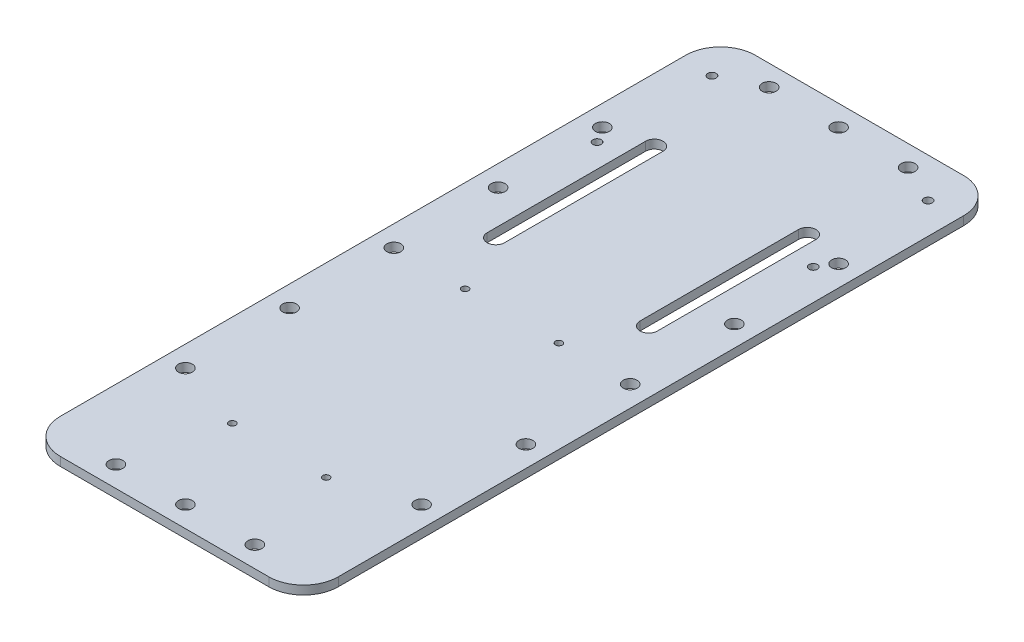
from build123d import *

# Parameters (mm, degrees)
SKETCH1_W           = 101.6
SKETCH1_H           = 254
BOSS_EXTRUDE1_DEPTH = 3.175
SKETCH2_R           = 2.54
SKETCH2_R_2         = 1.25000004
SKETCH2_R_3         = 1.524
CUT_EXTRUDE1_DEPTH  = 223.663234681
FILLET1_R           = 12.7
CUT_EXTRUDE7_DEPTH  = 223.663234681


with BuildPart() as part:
    # Sketch1 → Boss-Extrude1 (new body)
    with BuildSketch(Plane(origin=(0, 0, 0), x_dir=(1, 0, 0), z_dir=(0, 1, 0))):
        with Locations((20.100372359, -84.049692378)):
            Rectangle(SKETCH1_W, SKETCH1_H)
    extrude(amount=BOSS_EXTRUDE1_DEPTH)

    # Sketch2 → Cut-Extrude1 (cut, through all)
    with BuildSketch(Plane(origin=(0, 3.175, 0), x_dir=(1, 0, 0), z_dir=(0, 1, 0))):
        with Locations(Location((-5.299627641, 35.330307622, 0), (0, 0, 270))):
            Circle(SKETCH2_R)
        with Locations(Location((20.100372359, 35.330307622, 0), (0, 0, 270))):
            Circle(SKETCH2_R)
        with Locations(Location((45.500372359, 35.330307622, 0), (0, 0, 270))):
            Circle(SKETCH2_R)
        with Locations(Location((-23.079627641, -84.049692378, 0), (0, 0, 270))):
            Circle(SKETCH2_R)
        with Locations(Location((-23.079627641, -45.949692378, 0), (0, 0, 270))):
            Circle(SKETCH2_R)
        with Locations(Location((-23.079627641, -7.849692378, 0), (0, 0, 270))):
            Circle(SKETCH2_R)
        with Locations(Location((63.280372359, -7.849692378, 0), (0, 0, 90))):
            Circle(SKETCH2_R)
        with Locations(Location((63.280372359, -45.949692378, 0), (0, 0, 90))):
            Circle(SKETCH2_R)
        with Locations(Location((63.280372359, -84.049692378, 0), (0, 0, 90))):
            Circle(SKETCH2_R)
        with Locations(Location((63.280372359, -122.149692378, 0), (0, 0, 270))):
            Circle(SKETCH2_R)
        with Locations(Location((63.280372359, -160.249692378, 0), (0, 0, 270))):
            Circle(SKETCH2_R)
        with Locations(Location((-23.079627641, -160.249692378, 0), (0, 0, 90))):
            Circle(SKETCH2_R)
        with Locations(Location((-23.079627641, -122.149692378, 0), (0, 0, 90))):
            Circle(SKETCH2_R)
        with Locations(Location((45.500372359, -203.429692378, 0), (0, 0, 90))):
            Circle(SKETCH2_R)
        with Locations(Location((20.100372359, -203.429692378, 0), (0, 0, 90))):
            Circle(SKETCH2_R)
        with Locations(Location((-5.299627641, -203.429692378, 0), (0, 0, 90))):
            Circle(SKETCH2_R)
        with Locations(Location((2.955372359, -84.049692378, 0), (0, 0, 270))):
            Circle(SKETCH2_R_2)
        with Locations(Location((37.245372359, -84.049692378, 0), (0, 0, 90))):
            Circle(SKETCH2_R_2)
        with Locations(Location((37.245372359, -169.139692378, 0), (0, 0, 270))):
            Circle(SKETCH2_R_2)
        with Locations(Location((2.955372359, -169.139692378, 0), (0, 0, 90))):
            Circle(SKETCH2_R_2)
        with Locations(Location((-19.399627381, 28.542449069, 0), (0, 0, 270))):
            Circle(SKETCH2_R_3)
        with Locations(Location((59.600372099, 28.542449069, 0), (0, 0, 90))):
            Circle(SKETCH2_R_3)
        with Locations(Location((59.600372099, -13.457550751, 0), (0, 0, 270))):
            Circle(SKETCH2_R_3)
        with Locations(Location((-19.399627381, -13.457550751, 0), (0, 0, 90))):
            Circle(SKETCH2_R_3)
    extrude(amount=-CUT_EXTRUDE1_DEPTH, mode=Mode.SUBTRACT)

    # Fillet1
    fillet1_edges = [part.edges().sort_by_distance(p)[0] for p in [
        (-30.699627641, 1.5875, -42.950307622),
        (70.900372359, 1.5875, -42.950307622),
        (70.900372359, 1.5875, 211.049692378),
        (-30.699627641, 1.5875, 211.049692378),
    ]]
    fillet(fillet1_edges, radius=FILLET1_R)

    # Sketch4 → Cut-Extrude7 (cut, through all)
    with BuildSketch(Plane(origin=(0, 0, 0), x_dir=(1, 0, 0), z_dir=(0, 1, 0))):
        with BuildLine():
            Line((51.42781247, -4.28096808), (51.42781247, -62.218416676))
            ThreePointArc((51.42781247, -62.218416676), (48.25281247, -65.393416676), (45.07781247, -62.218416676))
            Line((45.07781247, -62.218416676), (45.07781247, -4.28096808))
            ThreePointArc((45.07781247, -4.28096808), (48.25281247, -1.10596808), (51.42781247, -4.28096808))
        make_face()
        with BuildLine():
            Line((-10.80218753, -4.28096808), (-10.80218753, -62.218416676))
            ThreePointArc((-10.80218753, -62.218416676), (-7.62718753, -65.393416676), (-4.45218753, -62.218416676))
            Line((-4.45218753, -62.218416676), (-4.45218753, -4.28096808))
            ThreePointArc((-4.45218753, -4.28096808), (-7.62718753, -1.10596808), (-10.80218753, -4.28096808))
        make_face()
    extrude(amount=CUT_EXTRUDE7_DEPTH, mode=Mode.SUBTRACT)


solid = part.part
